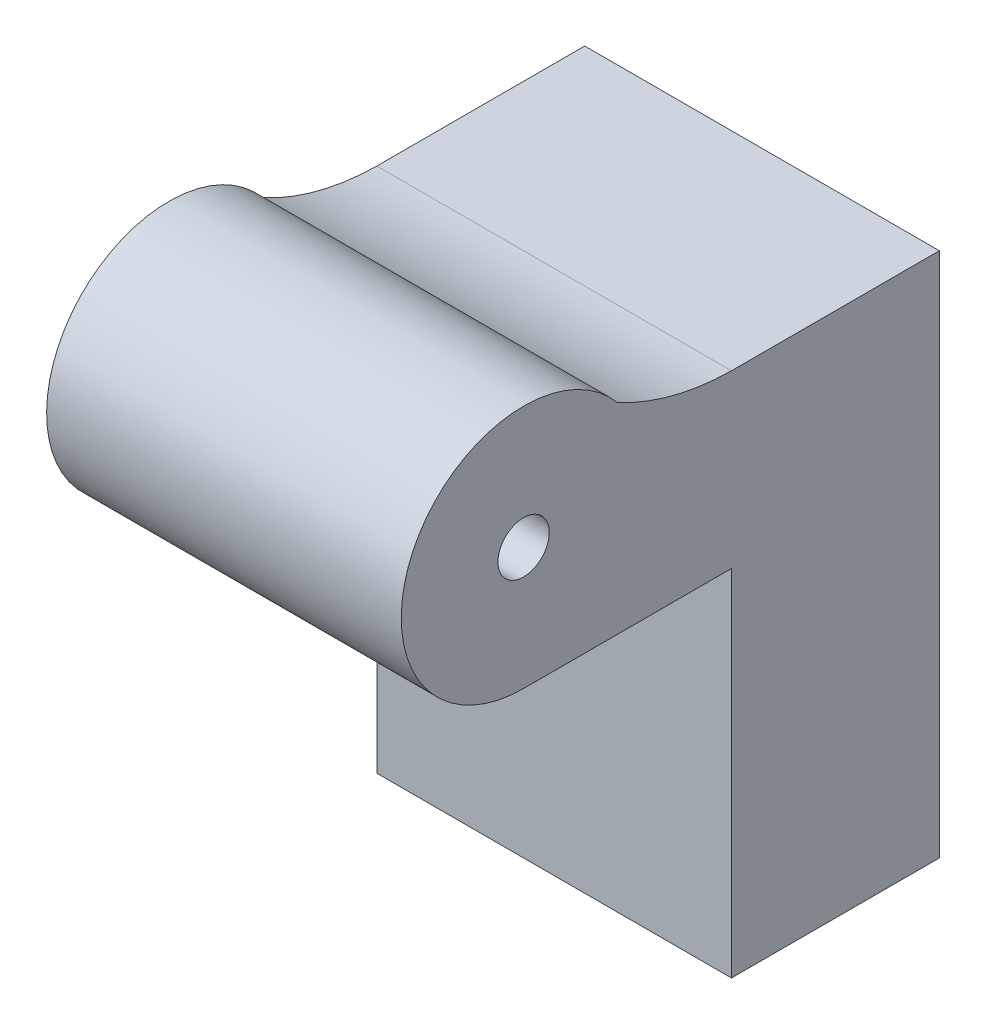
from build123d import *

# Parameters (mm, degrees)
CROQUIS1_W              = 29
CROQUIS1_H              = 17
SALIENTE_EXTRUIR1_DEPTH = 43
CROQUIS2_R              = 10
SALIENTE_EXTRUIR2_DEPTH = 29
CROQUIS3_R              = 2.1
CORTAR_EXTRUIR1_DEPTH   = 29
SALIENTE_EXTRUIR3_DEPTH = 29


with BuildPart() as part:
    # Croquis1 → Saliente-Extruir1 (new body)
    with BuildSketch(Plane(origin=(0, 0, 0), x_dir=(1, 0, 0), z_dir=(0, 1, 0))):
        with Locations((14.5, -8.5)):
            Rectangle(CROQUIS1_W, CROQUIS1_H)
    extrude(amount=SALIENTE_EXTRUIR1_DEPTH)



with BuildPart() as body_2:
    # Croquis2 → Saliente-Extruir2 (new body)
    with BuildSketch(Plane(origin=(29, 0, 0), x_dir=(0, 0, -1), z_dir=(1, 0, 0))):
        with Locations((-34, 39)):
            Circle(CROQUIS2_R)
    extrude(amount=-SALIENTE_EXTRUIR2_DEPTH)

    # Croquis3 → Cortar-Extruir1 (cut)
    with BuildSketch(Plane(origin=(29, 0, 0), x_dir=(0, 0, -1), z_dir=(1, 0, 0))):
        with Locations((-34, 39)):
            Circle(CROQUIS3_R)
    extrude(amount=-CORTAR_EXTRUIR1_DEPTH, mode=Mode.SUBTRACT)


with BuildPart() as part_1:
    add(part.part)

    add(body_2.part)  # Saliente-Extruir3 merges body 2
    # Croquis4 → Saliente-Extruir3 (add)
    with BuildSketch(Plane(origin=(29, 0, 0), x_dir=(0, 0, -1), z_dir=(1, 0, 0))):
        with BuildLine():
            Line((-34, 29), (-17, 29))
            Line((-17, 29), (-17, 43))
            ThreePointArc((-17, 43), (-21.814511478, 43.643262372), (-26.334473676, 45.421814866))
            ThreePointArc((-26.334473676, 45.421814866), (-24.938594241, 34.770233379), (-34, 29))
        make_face()
    extrude(amount=-SALIENTE_EXTRUIR3_DEPTH)


solid = part_1.part
